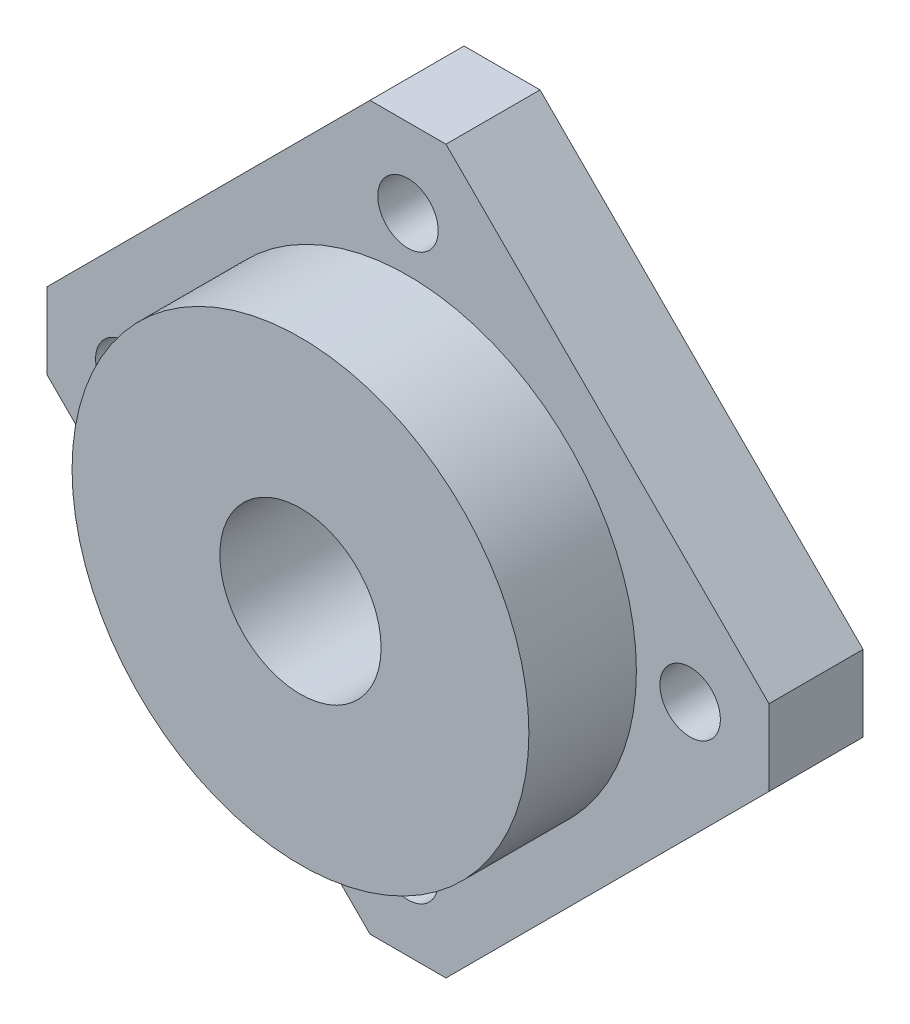
from build123d import *

# Parameters (mm, degrees)
EXTRUSION1_DEPTH = 7
SKETCH2_R        = 2.25
EXTRUSION2_DEPTH = 20
SKETCH3_R        = 6
EXTRUSION3_DEPTH = 20
EXTRUSION4_START = 8
SKETCH4_R        = 17
SKETCH4_R_2      = 6
EXTRUSION4_DEPTH = 8
CHAMFER1_SIZE    = 4
CHAMFER2_SIZE    = 4
CHAMFER3_SIZE    = 4
CHAMFER4_SIZE    = 4


with BuildPart() as part:
    # Sketch1 → Extrusion1 (new body)
    with BuildSketch(Plane.XY):
        Polygon((-29.69848481, 0), (0, 29.69848481), (29.69848481, 0), (0, -29.69848481), align=None)
    extrude(amount=EXTRUSION1_DEPTH)

    # Sketch2 → Extrusion2 (cut)
    with BuildSketch(Plane.XY.offset(7)):
        with Locations((0, 21)):
            Circle(SKETCH2_R)
        with Locations((21, 0)):
            Circle(SKETCH2_R)
        with Locations((0, -21)):
            Circle(SKETCH2_R)
        with Locations((-21, 0)):
            Circle(SKETCH2_R)
    extrude(amount=-EXTRUSION2_DEPTH, mode=Mode.SUBTRACT)

    # Sketch3 → Extrusion3 (cut)
    with BuildSketch(Plane.XY.offset(7)):
        Circle(SKETCH3_R)
    extrude(amount=-EXTRUSION3_DEPTH, mode=Mode.SUBTRACT)

    # Sketch4 → Extrusion4 (add)
    with BuildSketch(Plane.XY.offset(7).offset(EXTRUSION4_START)):
        with Locations(Location((0, 0, 0), (0, 0, 180))):
            Circle(SKETCH4_R)
        Circle(SKETCH4_R_2, mode=Mode.SUBTRACT)
    extrude(amount=-EXTRUSION4_DEPTH)

    # Chamfer1
    chamfer1_edges = [part.edges().sort_by_distance(p)[0] for p in [
        (0, 29.69848481, 3.5),
    ]]
    chamfer(chamfer1_edges, length=CHAMFER1_SIZE)

    # Chamfer2
    chamfer2_edges = [part.edges().sort_by_distance(p)[0] for p in [
        (29.69848481, 0, 3.5),
    ]]
    chamfer(chamfer2_edges, length=CHAMFER2_SIZE)

    # Chamfer3
    chamfer3_edges = [part.edges().sort_by_distance(p)[0] for p in [
        (-29.69848481, 0, 3.5),
    ]]
    chamfer(chamfer3_edges, length=CHAMFER3_SIZE)

    # Chamfer4
    chamfer4_edges = [part.edges().sort_by_distance(p)[0] for p in [
        (0, -29.69848481, 3.5),
    ]]
    chamfer(chamfer4_edges, length=CHAMFER4_SIZE)


solid = part.part
